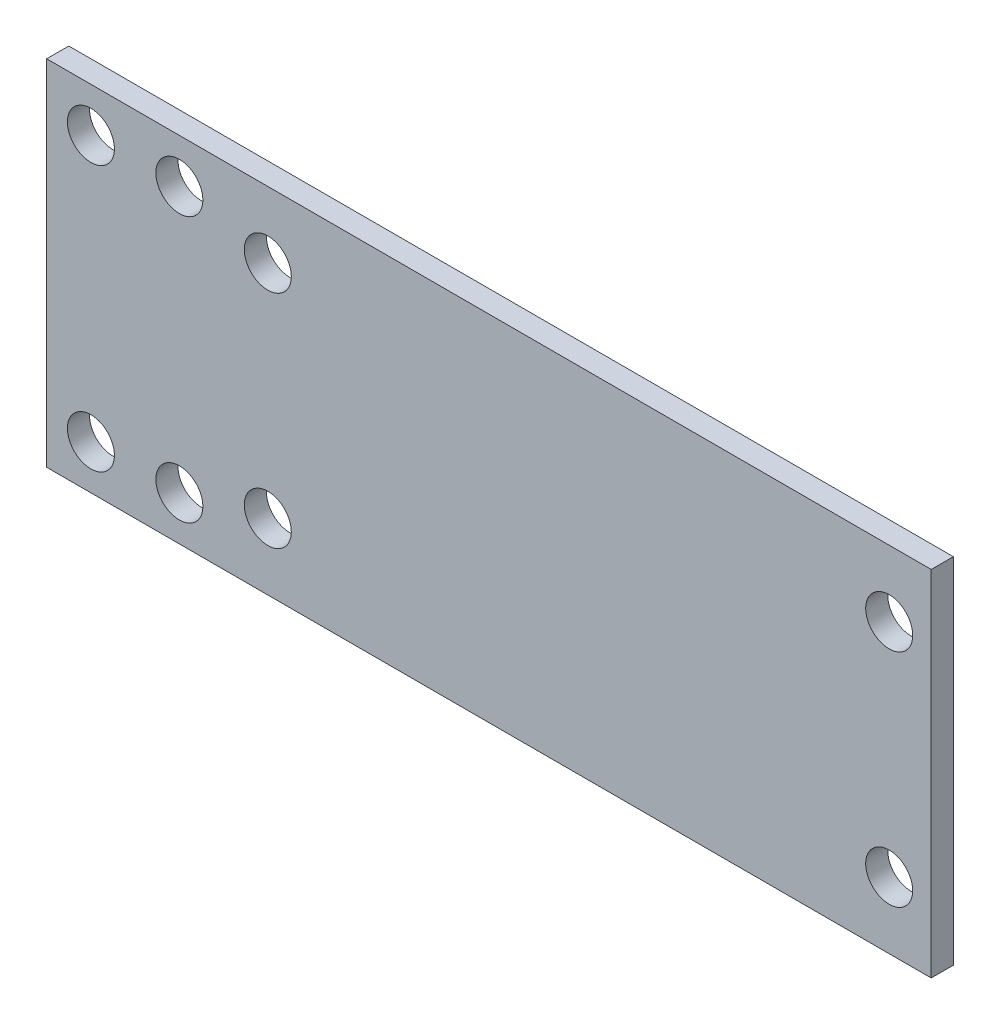
from build123d import *

# Parameters (mm, degrees)
SKETCH1_W                        = 127
SKETCH1_H                        = 50.8
BOSS_EXTRUDE1_DEPTH              = 3.175
F_17_64_0_26563_DIAMETER_HOLE1_D = 6.747002
F_17_64_0_26563_DIAMETER_HOLE2_D = 6.747002


with BuildPart() as part:
    # Sketch1 → Boss-Extrude1 (new body)
    with BuildSketch(Plane.XY):
        with Locations((-11.921727019, 3.749860724)):
            Rectangle(SKETCH1_W, SKETCH1_H)
    extrude(amount=BOSS_EXTRUDE1_DEPTH)

    # 17/64 (0.26563) Diameter Hole1 (through all)
    with Locations(Plane(origin=(-43.671727019, 19.624860724, 3.175), x_dir=(1, 0, 0), z_dir=(0, 0, 1))):
        with Locations((0, 0), (0, -31.75), (89.2175, 0), (89.2175, -31.75)):
            Hole(F_17_64_0_26563_DIAMETER_HOLE1_D / 2)

    # 17/64 (0.26563) Diameter Hole2 (through all)
    with Locations(Plane(origin=(-69.071727019, 22.799860724, 3.175), x_dir=(1, 0, 0), z_dir=(0, 0, 1))):
        with Locations((0, 0), (12.7, 0), (12.7, -38.1), (0, -38.1)):
            Hole(F_17_64_0_26563_DIAMETER_HOLE2_D / 2)


solid = part.part
